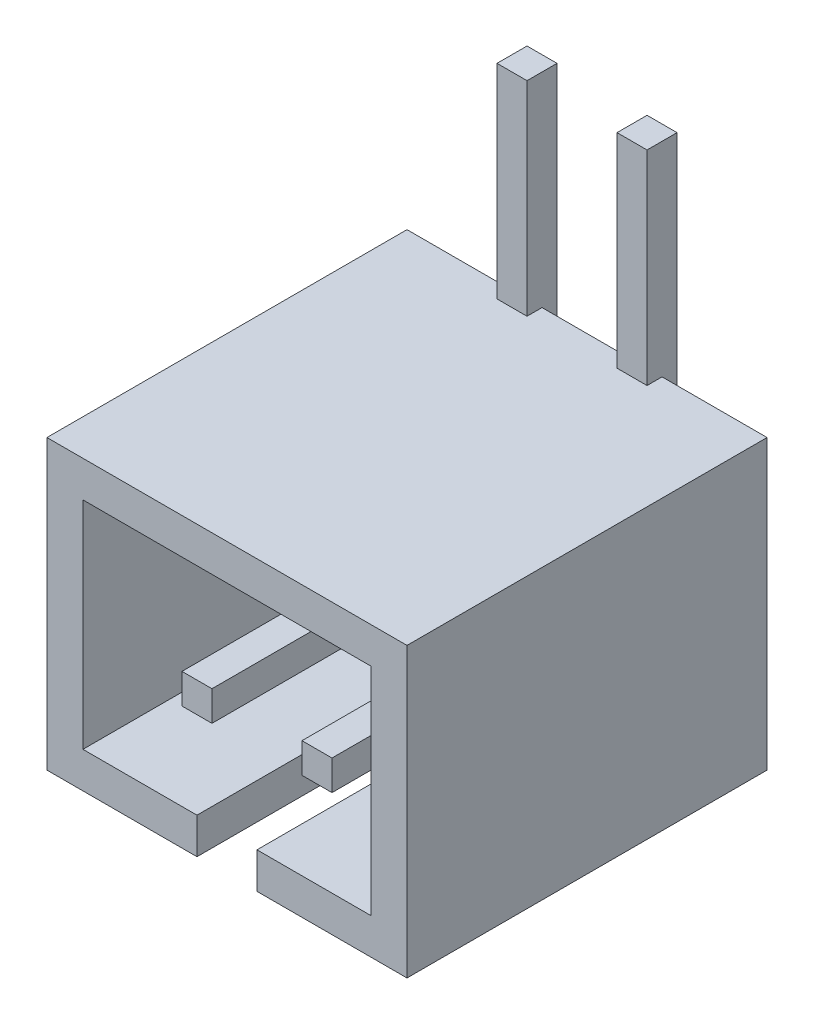
from build123d import *

# Parameters (mm, degrees)
SKETCH1_W           = 6
SKETCH1_H           = 4.8
BOSS_EXTRUDE1_DEPTH = 2
BOSS_EXTRUDE2_DEPTH = 4
PIN_DEPTH           = 0.25
LPATTERN1_COUNT     = 2
LPATTERN1_PITCH     = 2


with BuildPart() as part:
    # Sketch1 → Boss-Extrude1 (new body)
    with BuildSketch(Plane.XY):
        Rectangle(SKETCH1_W, SKETCH1_H)
    extrude(amount=BOSS_EXTRUDE1_DEPTH)

    # Sketch2 → Boss-Extrude2 (add)
    with BuildSketch(Plane.XY.offset(2)):
        Polygon((-0.5, -2.4), (-0.5, -1.8), (-2.4, -1.8), (-2.4, 1.8), (2.4, 1.8), (2.4, -1.8), (0.5, -1.8), (0.5, -2.4), (3, -2.4), (3, 2.4), (-3, 2.4), (-3, -2.4), align=None)
    extrude(amount=BOSS_EXTRUDE2_DEPTH)

    # Sketch3 → Pin (add, symmetric)
    with BuildSketch(Plane.ZY.offset(1)):
        Polygon((0.25, 5.8), (0.25, -0.35), (5.5, -0.35), (5.5, -0.85), (-0.25, -0.85), (-0.25, 5.8), align=None)
    pin = extrude(amount=PIN_DEPTH, both=True)

    # LPattern1: Pin ×2
    with Locations(*[(i * LPATTERN1_PITCH, 0, 0) for i in range(1, LPATTERN1_COUNT)]):
        add(pin)


solid = part.part
